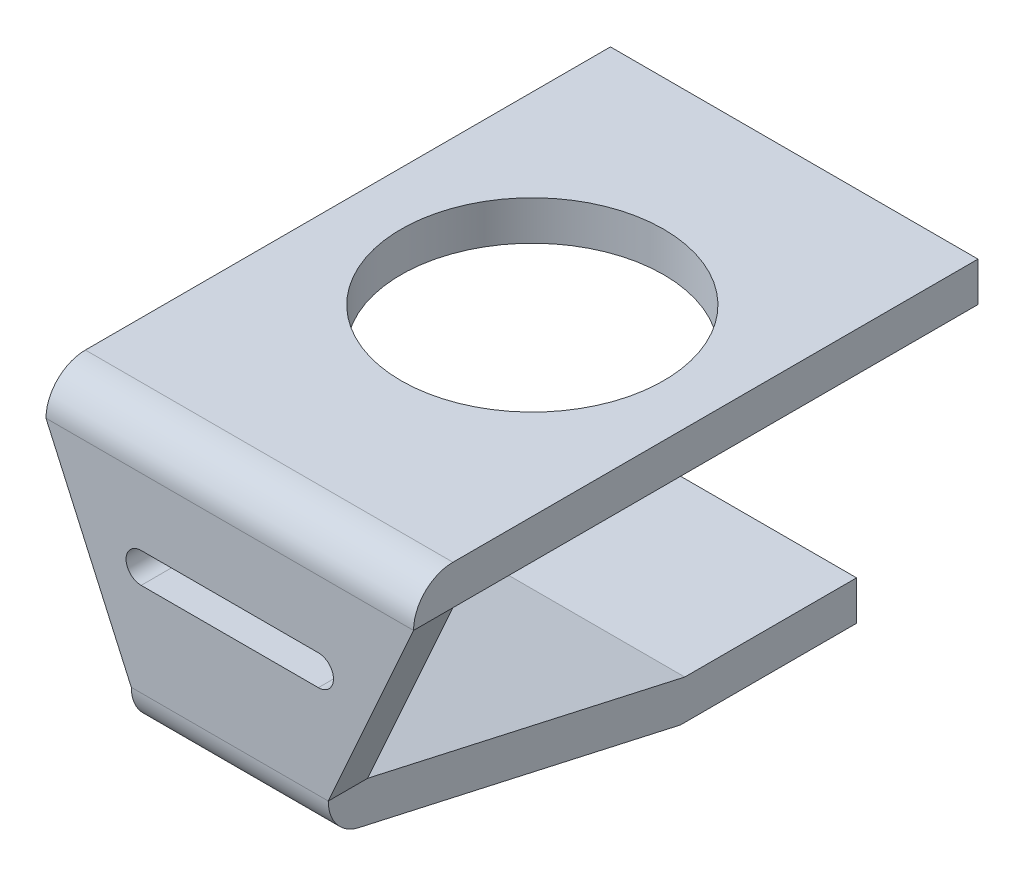
from build123d import *

# Parameters (mm, degrees)
EXTRUDE_1_DEPTH     = 2.8
SKETCH_2_R          = 1
CUT_EXTRUDE_1_DEPTH = 0.35
CUT_EXTRUDE_2_DEPTH = 5.84
FILLET_1_R          = 0.3
FILLET_2_R          = 0.3
CUT_EXTRUDE_3_DEPTH = 0.38


with BuildPart() as part:
    # Эскиз1 → Бобышка-Вытянуть1 (new body)
    with BuildSketch(Plane(origin=(0, 0, 0), x_dir=(0, 0, -1), z_dir=(1, 0, 0))):
        Polygon((-2, -0.15), (2, -0.15), (2, 0.15), (-2.3, 0.15), (-2.3, -0.15), (-2.3, -1.840737663), (0.383188303, -2.440296098), (1.724844915, -2.440296098), (1.724844915, -2.140296098), (0.416297552, -2.140296098), (-2, -1.600374403), align=None)
    extrude(amount=-EXTRUDE_1_DEPTH)

    # Эскиз2 → Вырез-Вытянуть1 (cut)
    with BuildSketch(Plane(origin=(0, 0.15, 0), x_dir=(1, 0, 0), z_dir=(0, 1, 0))):
        with Locations(Location((-1.395, 0, 0), (0, 0, 270))):
            Circle(SKETCH_2_R)
    extrude(amount=-CUT_EXTRUDE_1_DEPTH, mode=Mode.SUBTRACT)

    # Эскиз3 → Вырез-Вытянуть2 (cut)
    with BuildSketch(Plane.XY.offset(2.3)):
        Polygon((0.104580197, -0.15), (0, -0.15), (0, -1.840737663), (-0.507452735, -1.840737663), (-0.65, -1.840737663), (-0.65, -2.582228504), (-2.15, -2.582228504), (-2.15, -1.840737663), (-2.8, -1.840737663), (-2.8, -0.15), (-2.942884437, -0.15), (-2.942884437, -2.979664713), (0.104580197, -2.979664713), align=None)
        Polygon((-2.8, -1.840737663), (-2.15, -1.840737663), (-2.15, -1.600830544), (-2.8, -0.15), align=None)
        Polygon((0, -1.840737663), (0, -0.15), (-0.65, -1.600830544), (-0.65, -1.840737663), (-0.507452735, -1.840737663), align=None)
    extrude(amount=-CUT_EXTRUDE_2_DEPTH, mode=Mode.SUBTRACT)

    # Скругление1
    fillet_1_edges = [part.edges().sort_by_distance(p)[0] for p in [
        (-1.4, 0.15, 2.3),
    ]]
    fillet(fillet_1_edges, radius=FILLET_1_R)

    # Скругление2
    fillet_2_edges = [part.edges().sort_by_distance(p)[0] for p in [
        (-1.4, -1.840737663, 2.3),
    ]]
    fillet(fillet_2_edges, radius=FILLET_2_R)

    # Эскиз4 → Вырез-Вытянуть3 (cut)
    with BuildSketch(Plane.XY.offset(2.3)):
        with BuildLine():
            Line((-2.075, -0.659889324), (-0.725, -0.659889324))
            ThreePointArc((-0.725, -0.659889324), (-0.609889324, -0.775), (-0.725, -0.890110676))
            Line((-0.725, -0.890110676), (-2.075, -0.890110676))
            ThreePointArc((-2.075, -0.890110676), (-2.190110676, -0.775), (-2.075, -0.659889324))
        make_face()
    extrude(amount=-CUT_EXTRUDE_3_DEPTH, mode=Mode.SUBTRACT)


solid = part.part
